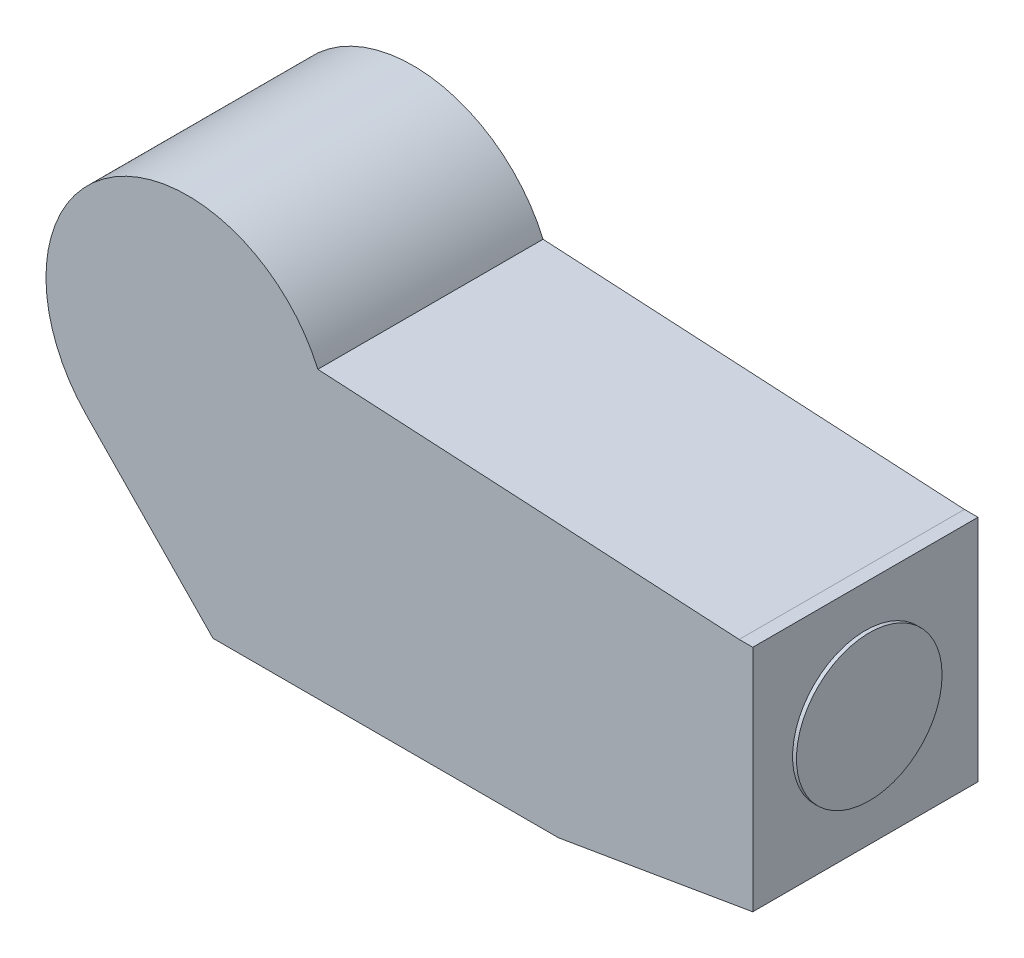
from build123d import *

# Parameters (mm, degrees)
BOSS_EXTRUDE1_DEPTH = 58
SKETCH2_R           = 37.5
BOSS_EXTRUDE2_DEPTH = 2


with BuildPart() as part:
    # Sketch1 → Boss-Extrude1 (new, symmetric)
    with BuildSketch(Plane.XY):
        with BuildLine():
            Line((67, 28.982753492), (284, 17))
            Line((284, 17), (291, 17))
            Line((291, 17), (291, -101))
            Line((291, -101), (191, -118))
            Line((191, -118), (13, -118))
            Line((13, -118), (-52.304922539, -50.92342367))
            ThreePointArc((-52.304922539, -50.92342367), (-40.62309211, 60.652818462), (67, 28.982753492))
        make_face()
    extrude(amount=BOSS_EXTRUDE1_DEPTH, both=True)

    # Sketch2 → Boss-Extrude2 (add)
    with BuildSketch(Plane(origin=(291, 0, 0), x_dir=(0, 0, -1), z_dir=(1, 0, 0))):
        with Locations((0, -42)):
            Circle(SKETCH2_R)
    extrude(amount=BOSS_EXTRUDE2_DEPTH)


solid = part.part
